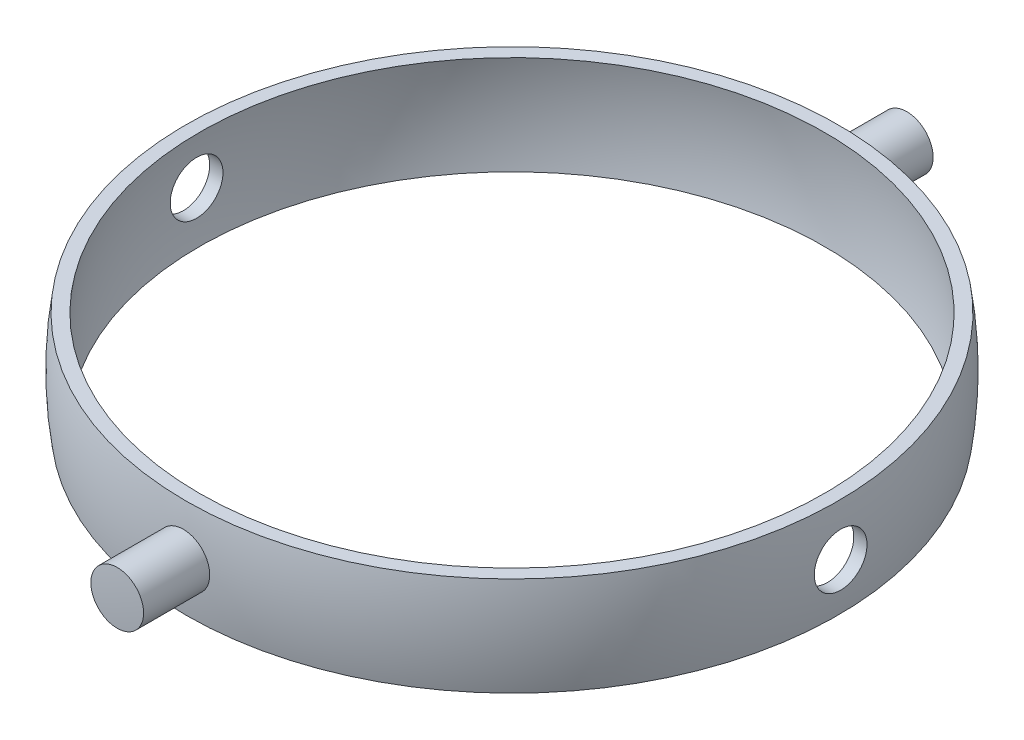
from build123d import *

# Parameters (mm, degrees)
CUT_EXTRUDE1_DEPTH       = 72.107313267
CUT_EXTRUDE1_DEPTH_BACK  = 72.107313267
SKETCH2_R                = 4
BOSS_EXTRUDE1_REACH      = 122.997
BOSS_EXTRUDE1_END_RADIUS = 50
SKETCH3_R                = 4


with BuildPart() as part:
    # Sketch1 → Revolve1 (revolve)
    with BuildSketch(Plane.XY):
        with BuildLine():
            Line((-49.434299833, 7.5), (-47.410441888, 7.5))
            ThreePointArc((-47.410441888, 7.5), (-48, 0), (-47.410441888, -7.5))
            Line((-47.410441888, -7.5), (-49.434299833, -7.5))
            ThreePointArc((-49.434299833, -7.5), (-50, 0), (-49.434299833, 7.5))
        make_face()
    revolve(axis=Axis((0, 18.420621119, 0), (0, -1, 0)))

    # Sketch2 → Cut-Extrude1 (cut, two sides: drawn at the far end of the back side and taken through both)
    with BuildSketch(Plane(origin=(0, 0, 0), x_dir=(0, 0, -1), z_dir=(1, 0, 0)).offset(-CUT_EXTRUDE1_DEPTH_BACK)):
        Circle(SKETCH2_R)
    extrude(amount=CUT_EXTRUDE1_DEPTH + CUT_EXTRUDE1_DEPTH_BACK, mode=Mode.SUBTRACT)

    # Boss-Extrude1: up to this sphere (the profile starts outside it)
    boss_extrude1_end = Location((0, 0, 0)) * Sphere(BOSS_EXTRUDE1_END_RADIUS, mode=Mode.PRIVATE)
    # Sketch3 → Boss-Extrude1 (add, up to the surface)
    with BuildSketch(Plane.XY.offset(60), mode=Mode.PRIVATE) as boss_extrude1_sk1:
        Circle(SKETCH3_R)
    boss_extrude1_tool1 = extrude(boss_extrude1_sk1.sketch, amount=-BOSS_EXTRUDE1_REACH, mode=Mode.PRIVATE) - boss_extrude1_end
    boss_extrude1 = boss_extrude1_tool1.solids().sort_by_distance((0, 0, 60))[0]
    add(boss_extrude1)

    # Mirror1: Boss-Extrude1 across plane
    add(boss_extrude1.mirror(Plane.XY))

    # Sketch4 → Cut-Revolve1 (revolve, cut)
    with BuildSketch(Plane(origin=(0, 0, 0), x_dir=(0, 0, -1), z_dir=(1, 0, 0))):
        with BuildLine():
            Line((0, 70), (0, 60))
            ThreePointArc((0, 60), (-60, 0), (0, -60))
            Line((0, -60), (0, -70))
            ThreePointArc((0, -70), (-70, 0), (0, 70))
        make_face()
    revolve(axis=Axis((0, 43.024434939, 0), (0, -1, 0)), mode=Mode.SUBTRACT)


solid = part.part
